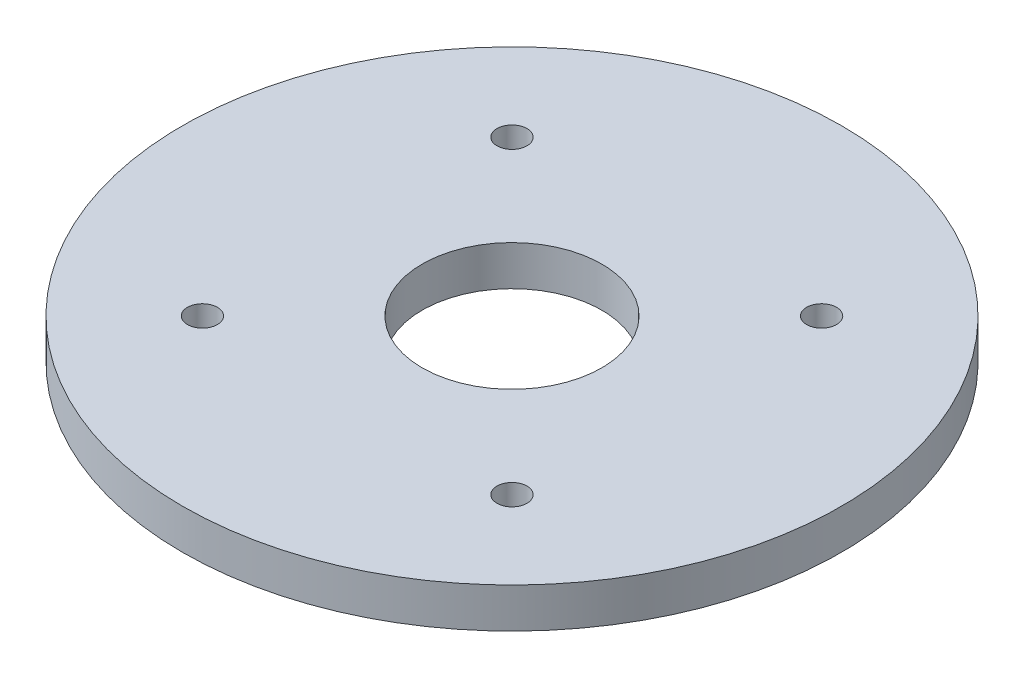
from build123d import *

# Parameters (mm, degrees)
SKETCH1_R           = 33
SKETCH1_R_2         = 1.5
SKETCH1_R_3         = 9
BOSS_EXTRUDE1_DEPTH = 4


with BuildPart() as part:
    # Sketch1 → Boss-Extrude1 (new body)
    with BuildSketch(Plane(origin=(0, 0, 0), x_dir=(1, 0, 0), z_dir=(0, 1, 0))):
        with Locations(Location((0, 0, 0), (0, 0, 270))):
            Circle(SKETCH1_R)
        with Locations(Location((-15.5, 15.5, 0), (0, 0, 270))):
            Circle(SKETCH1_R_2, mode=Mode.SUBTRACT)
        with Locations(Location((15.5, 15.5, 0), (0, 0, 270))):
            Circle(SKETCH1_R_2, mode=Mode.SUBTRACT)
        with Locations(Location((-15.5, -15.5, 0), (0, 0, 270))):
            Circle(SKETCH1_R_2, mode=Mode.SUBTRACT)
        with Locations(Location((15.5, -15.5, 0), (0, 0, 270))):
            Circle(SKETCH1_R_2, mode=Mode.SUBTRACT)
        with Locations(Location((0, 0, 0), (0, 0, 270))):
            Circle(SKETCH1_R_3, mode=Mode.SUBTRACT)
    extrude(amount=BOSS_EXTRUDE1_DEPTH)


solid = part.part
